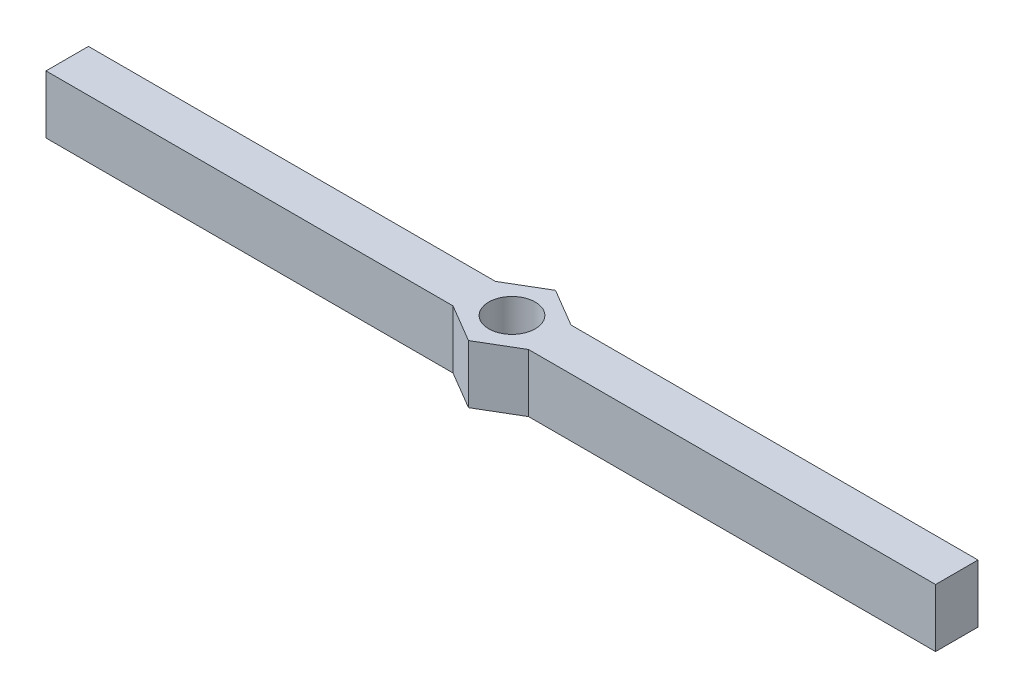
from build123d import *

# Parameters (mm, degrees)
SKETCH1_R           = 4
BOSS_EXTRUDE1_DEPTH = 10


with BuildPart() as part:
    # Sketch1 → Boss-Extrude1 (new body)
    with BuildSketch(Plane(origin=(0, 0, 0), x_dir=(1, 0, 0), z_dir=(0, 1, 0))):
        Polygon((0, 7.483019345), (6.500824903, 3.648436412), (76.500824903, 3.648436412), (76.500824903, -3.648436412), (6.500824903, -3.648436412), (0, -7.483019345), (-6.500824903, -3.648436412), (-76.500824903, -3.648436412), (-76.500824903, 3.648436412), (-6.500824903, 3.648436412), align=None)
        with Locations(Location((0, 0, 0), (0, 0, 270))):
            Circle(SKETCH1_R, mode=Mode.SUBTRACT)
    extrude(amount=BOSS_EXTRUDE1_DEPTH)


solid = part.part
